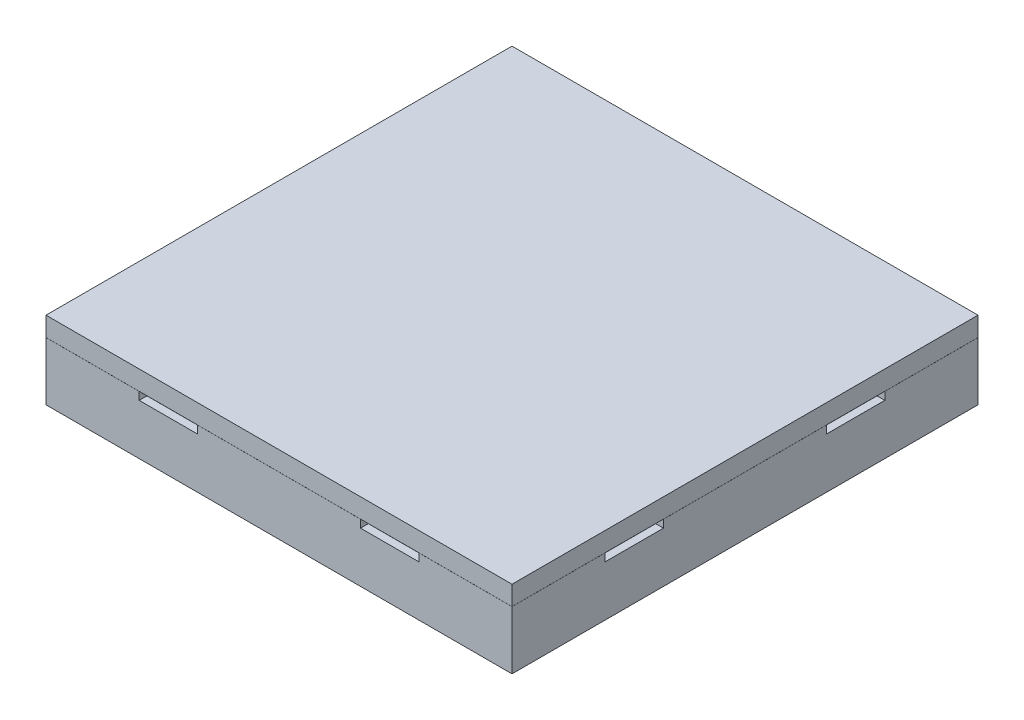
from build123d import *

# Parameters (mm, degrees)
SKETCH_1_W          = 600
SKETCH_1_H          = 600
EXTRUDE_1_DEPTH     = 200
CUT_EXTRUDE_1_DEPTH = 20
CUT_EXTRUDE_2_DEPTH = 20


with BuildPart() as part:
    # 草图1 → 凸台-拉伸1 (new body)
    with BuildSketch(Plane(origin=(0, 0, 0), x_dir=(1, 0, 0), z_dir=(0, 1, 0))):
        with Locations((-300, -300)):
            Rectangle(SKETCH_1_W, SKETCH_1_H)
    extrude(amount=EXTRUDE_1_DEPTH)

    # 草图2 → 切除-拉伸1 (cut)
    with BuildSketch(Plane.ZY.offset(600)):
        Polygon((600, 150.2), (0, 150.2), (0, 150), (210, 150), (210, 130), (360, 130), (360, 150), (600, 150), align=None)
    extrude(amount=-CUT_EXTRUDE_1_DEPTH, mode=Mode.SUBTRACT)

    # 草图3 → 切除-拉伸2 (cut)
    with BuildSketch(Plane.XY.offset(600)):
        Polygon((-580, 150.2), (-580, 150), (-360, 150), (-360, 130), (-210, 130), (-210, 150), (0, 150), (0, 150.2), align=None)
    extrude(amount=-CUT_EXTRUDE_2_DEPTH, mode=Mode.SUBTRACT)

    # 镜向1: part across plane


with BuildPart() as part_1:
    add(part.part)
    add(part.part.mirror(Plane(origin=(0, 200, 0), x_dir=(1, 0, 0), z_dir=(0, 0, 1))))

    # 镜向2: part across plane


with BuildPart() as part_2:
    add(part_1.part)
    add(part_1.part.mirror(Plane(origin=(0, 200, 0), x_dir=(0, 0, 1), z_dir=(-1, 0, 0))))


solid = part_2.part
